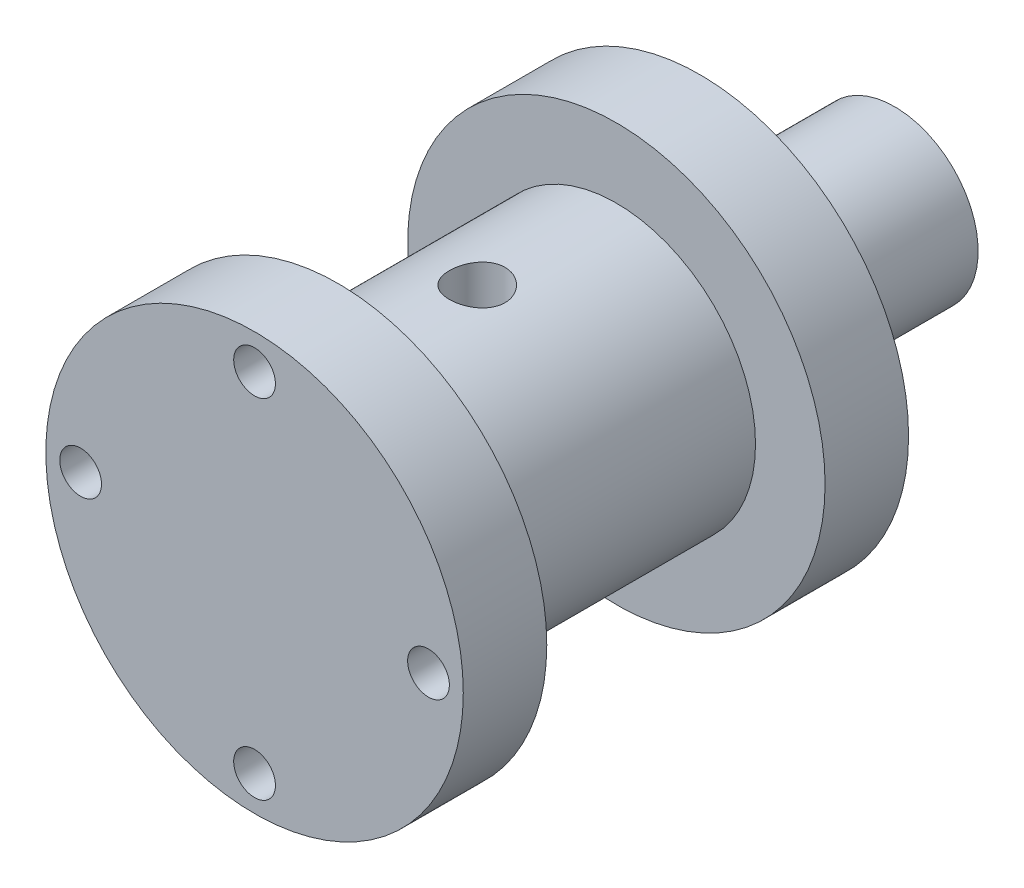
from build123d import *

# Parameters (mm, degrees)
BOSS_EXTRUDE1_DEPTH      = 5
BOSS_EXTRUDE1_DEPTH_BACK = 5
SKETCH1_R                = 5
SKETCH3_R                = 7.5
BOSS_EXTRUDE2_DEPTH      = 3
SKETCH4_R                = 1
CUT_EXTRUDE1_DEPTH       = 17.628289148
SKETCH5_R                = 0.75
CUT_EXTRUDE2_DEPTH       = 17.777961736
CIRPATTERN1_COUNT        = 4
SKETCH6_R                = 3
BOSS_EXTRUDE3_DEPTH      = 7


with BuildPart() as part:
    # Sketch1 → Boss-Extrude1 (new, two sides: drawn at the far end of the back side and taken through both)
    with BuildSketch(Plane.XY.offset(-BOSS_EXTRUDE1_DEPTH_BACK)):
        Circle(SKETCH1_R)
    extrude(amount=BOSS_EXTRUDE1_DEPTH + BOSS_EXTRUDE1_DEPTH_BACK)

    # Sketch3 → Boss-Extrude2 (add)
    with BuildSketch(Plane.XY.offset(5)):
        Circle(SKETCH3_R)
    boss_extrude2 = extrude(amount=BOSS_EXTRUDE2_DEPTH)

    # Mirror1: Boss-Extrude2 across plane
    add(boss_extrude2.mirror(Plane.XY))

    # Sketch4 → Cut-Extrude1 (cut, through all)
    with BuildSketch(Plane(origin=(0, 5, 0), x_dir=(1, 0, 0), z_dir=(0, 1, 0))):
        Circle(SKETCH4_R)
    extrude(amount=-CUT_EXTRUDE1_DEPTH, mode=Mode.SUBTRACT)

    # Sketch5 → Cut-Extrude2 (cut, through all)
    with BuildSketch(Plane(origin=(0, 0, 5), x_dir=(-1, 0, 0), z_dir=(0, 0, -1))):
        with Locations((0, 6.25)):
            Circle(SKETCH5_R)
    cut_extrude2 = extrude(amount=-CUT_EXTRUDE2_DEPTH, mode=Mode.SUBTRACT)

    # CirPattern1: Cut-Extrude2 ×4 about axis
    cirpattern1_axis = Axis((0, 0, -5), (0, 0, 1))
    for i in range(1, CIRPATTERN1_COUNT):
        add(cut_extrude2.rotate(cirpattern1_axis, i * 360 / CIRPATTERN1_COUNT), mode=Mode.SUBTRACT)

    # Sketch6 → Boss-Extrude3 (add)
    with BuildSketch(Plane(origin=(0, 0, -8), x_dir=(-1, 0, 0), z_dir=(0, 0, -1))):
        Circle(SKETCH6_R)
    extrude(amount=BOSS_EXTRUDE3_DEPTH)


solid = part.part
